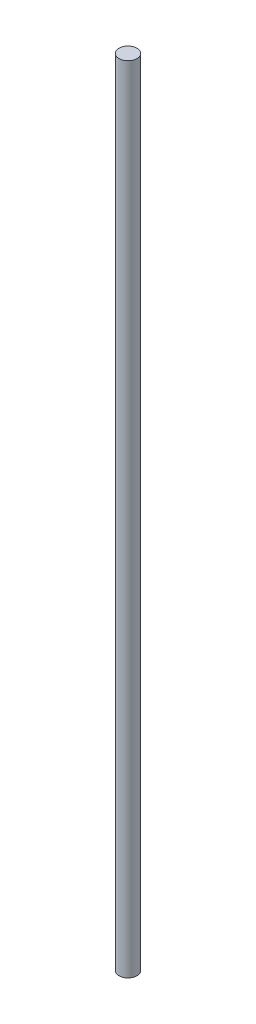
from build123d import *

# Parameters (mm, degrees)
SKETCH1_R                 = 8
BOSS_EXTRUDE1_DEPTH       = 705
M8X1_0_TAPPED_HOLE1_D     = 7
M8X1_0_TAPPED_HOLE1_DEPTH = 19
M8X1_0_TAPPED_HOLE1_TIP   = 2.103012167


with BuildPart() as part:
    # Sketch1 → Boss-Extrude1 (new body)
    with BuildSketch(Plane(origin=(0, 0, 0), x_dir=(1, 0, 0), z_dir=(0, 1, 0))):
        with Locations(Location((0, 0, 0), (0, 0, 270))):
            Circle(SKETCH1_R)
    extrude(amount=BOSS_EXTRUDE1_DEPTH)

    # M8x1.0 Tapped Hole1
    with Locations(Plane(origin=(0, 0, 0), x_dir=(-1, 0, 0), z_dir=(0, -1, 0))):
        with Locations((0, 0)):
            Hole(M8X1_0_TAPPED_HOLE1_D / 2, depth=M8X1_0_TAPPED_HOLE1_DEPTH)
            with Locations((0, 0, -(M8X1_0_TAPPED_HOLE1_DEPTH + M8X1_0_TAPPED_HOLE1_TIP / 2))):  # 118° drill point
                Cone(0, M8X1_0_TAPPED_HOLE1_D / 2, M8X1_0_TAPPED_HOLE1_TIP, mode=Mode.SUBTRACT)


solid = part.part
